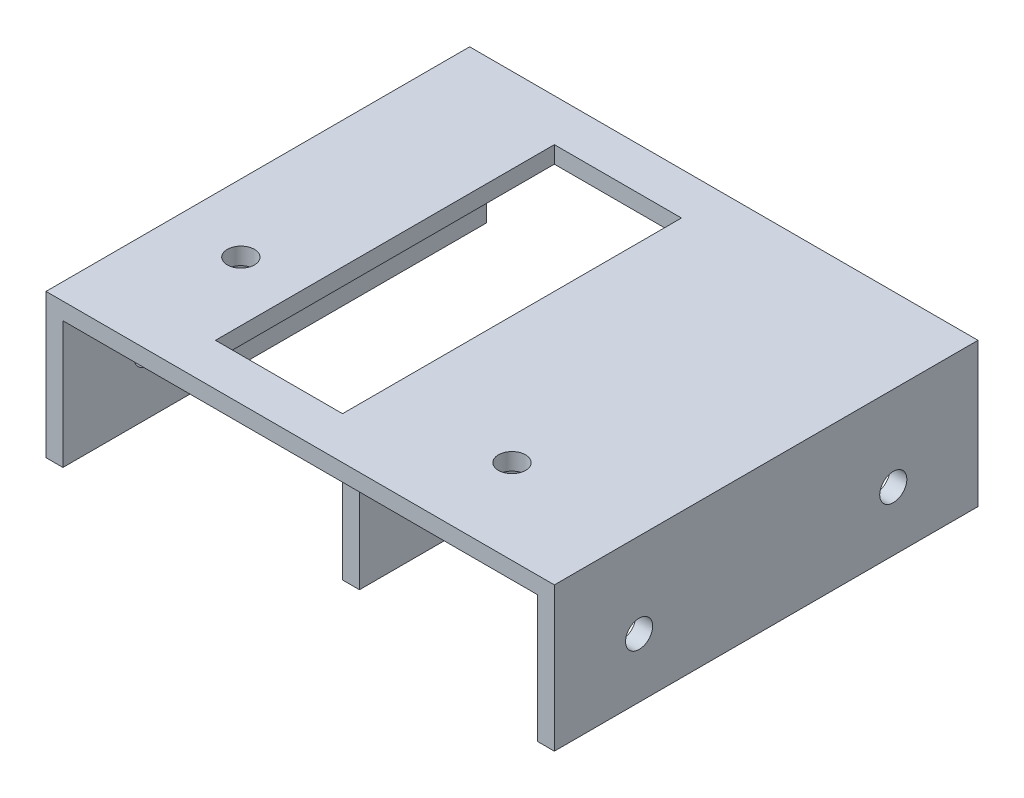
from build123d import *

# Parameters (mm, degrees)
BOSS_EXTRUDE1_DEPTH = 50
SKETCH2_R           = 1.6
CUT_EXTRUDE1_DEPTH  = 80.931220434
SKETCH3_W           = 2
SKETCH3_H           = 40
BOSS_EXTRUDE2_DEPTH = 17
SKETCH5_R           = 1.6
CUT_EXTRUDE3_DEPTH  = 2
SKETCH6_R           = 1.6
CUT_EXTRUDE4_DEPTH  = 80.931220434
SKETCH7_W           = 15
SKETCH7_H           = 40
CUT_EXTRUDE5_DEPTH  = 2


with BuildPart() as part:
    # Sketch1 → Boss-Extrude1 (new body)
    with BuildSketch(Plane.XY):
        Polygon((0, 0), (0, 17), (60, 17), (60, 0), (58, 0), (58, 15), (2, 15), (2, 0), align=None)
    extrude(amount=BOSS_EXTRUDE1_DEPTH)

    # Sketch2 → Cut-Extrude1 (cut, through all)
    with BuildSketch(Plane(origin=(60, 0, 0), x_dir=(0, 0, -1), z_dir=(1, 0, 0))):
        with Locations(Location((-40, 7, 0), (0, 0, 90))):
            Circle(SKETCH2_R)
        with Locations(Location((-10, 7, 0), (0, 0, 180))):
            Circle(SKETCH2_R)
    extrude(amount=-CUT_EXTRUDE1_DEPTH, mode=Mode.SUBTRACT)

    # Sketch3 → Boss-Extrude2 (add)
    with BuildSketch(Plane(origin=(0, 17, 0), x_dir=(1, 0, 0), z_dir=(0, 1, 0))):
        with Locations((31, -25)):
            Rectangle(SKETCH3_W, SKETCH3_H)
    extrude(amount=-BOSS_EXTRUDE2_DEPTH)

    # Sketch5 → Cut-Extrude3 (cut)
    with BuildSketch(Plane(origin=(32, 0, 0), x_dir=(0, 0, -1), z_dir=(1, 0, 0))):
        with Locations((-37, 5)):
            Circle(SKETCH5_R)
        with Locations(Location((-13, 5, 0), (0, 0, 180))):
            Circle(SKETCH5_R)
    extrude(amount=-CUT_EXTRUDE3_DEPTH, mode=Mode.SUBTRACT)

    # Sketch6 → Cut-Extrude4 (cut, through all)
    with BuildSketch(Plane(origin=(0, 17, 0), x_dir=(1, 0, 0), z_dir=(0, 1, 0))):
        with Locations(Location((45, -40, 0), (0, 0, 270))):
            Circle(SKETCH6_R)
        with Locations(Location((8, -35, 0), (0, 0, 270))):
            Circle(SKETCH6_R)
    extrude(amount=-CUT_EXTRUDE4_DEPTH, mode=Mode.SUBTRACT)

    # Sketch7 → Cut-Extrude5 (cut)
    with BuildSketch(Plane.XZ.offset(-15)):
        with Locations((22.5, 25)):
            Rectangle(SKETCH7_W, SKETCH7_H)
    extrude(amount=-CUT_EXTRUDE5_DEPTH, mode=Mode.SUBTRACT)


solid = part.part
